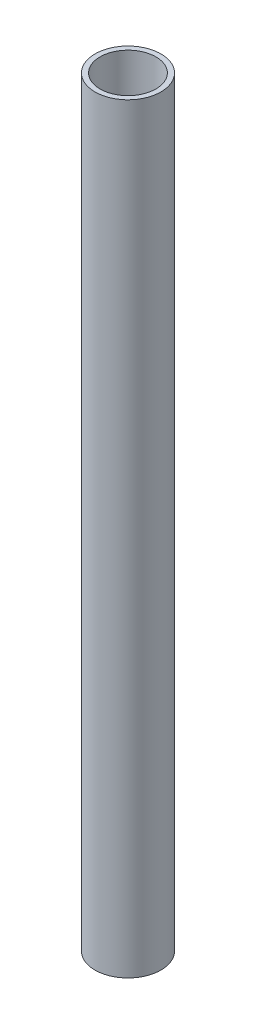
from build123d import *

# Parameters (mm, degrees)
SKETCH1_R           = 13
SKETCH1_R_2         = 11
BOSS_EXTRUDE1_DEPTH = 150


with BuildPart() as part:
    # Sketch1 → Boss-Extrude1 (new, symmetric)
    with BuildSketch(Plane(origin=(0, 0, 0), x_dir=(1, 0, 0), z_dir=(0, 1, 0))):
        with Locations(Location((0, 0, 0), (0, 0, 270))):
            Circle(SKETCH1_R)
        with Locations(Location((0, 0, 0), (0, 0, 270))):
            Circle(SKETCH1_R_2, mode=Mode.SUBTRACT)
    extrude(amount=BOSS_EXTRUDE1_DEPTH, both=True)


solid = part.part
